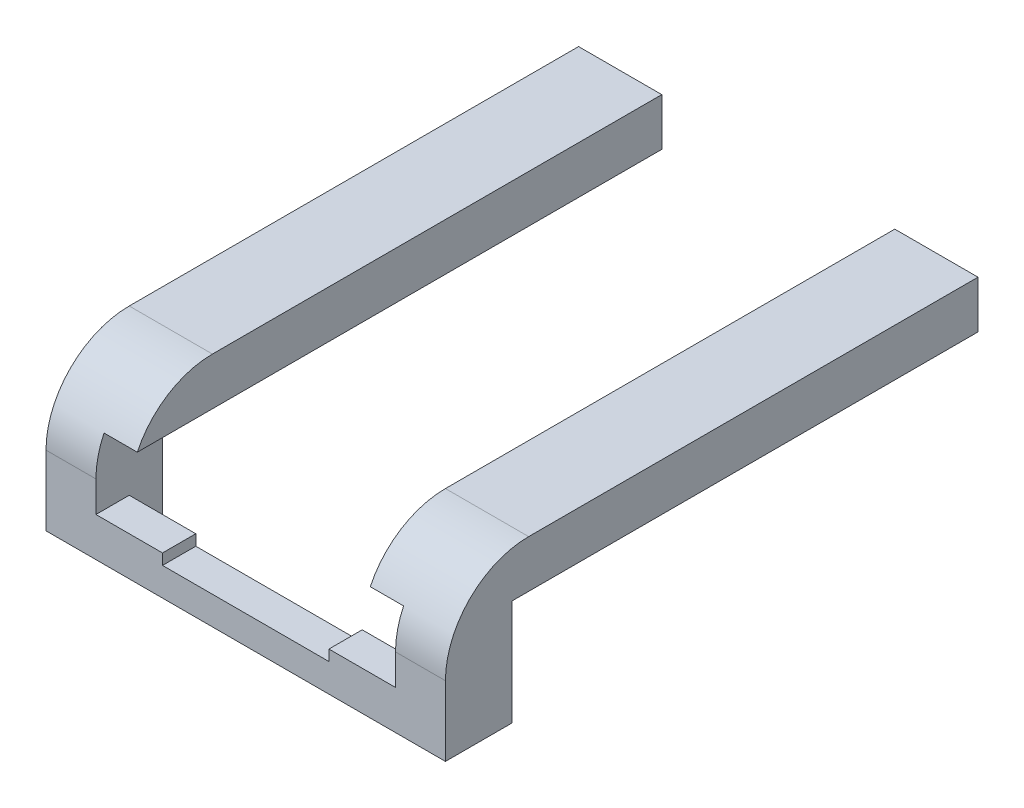
from build123d import *

# Parameters (mm, degrees)
BOSS_EXTRU_1_DEPTH = 1.7
ESQUISSE2_W        = 3
ESQUISSE2_H        = 4
BOSS_EXTRU_2_DEPTH = 7.5
ESQUISSE3_W        = 5
ESQUISSE3_H        = 32
BOSS_EXTRU_3_DEPTH = 2.85
CONG_1_R           = 5
ESQUISSE4_W        = 4
ESQUISSE4_H        = 2
BOSS_EXTRU_4_DEPTH = 0.65


with BuildPart() as part:
    # Esquisse1 → Boss.-Extru.1 (new body)
    with BuildSketch(Plane(origin=(0, 0, 0), x_dir=(1, 0, 0), z_dir=(0, 1, 0))):
        Polygon((-12, 4), (-9, 4), (-9, 2), (9, 2), (9, 4), (12, 4), (12, 0), (-12, 0), align=None)
    extrude(amount=BOSS_EXTRU_1_DEPTH)

    # Esquisse2 → Boss.-Extru.2 (add)
    with BuildSketch(Plane(origin=(0, 1.7, 0), x_dir=(1, 0, 0), z_dir=(0, 1, 0))):
        with Locations((-10.5, 2)):
            Rectangle(ESQUISSE2_W, ESQUISSE2_H)
        with Locations((10.5, 2)):
            Rectangle(ESQUISSE2_W, ESQUISSE2_H)
    extrude(amount=BOSS_EXTRU_2_DEPTH)

    # Esquisse3 → Boss.-Extru.3 (add)
    with BuildSketch(Plane(origin=(0, 9.2, 0), x_dir=(1, 0, 0), z_dir=(0, 1, 0))):
        with Locations((-9.5, 16)):
            Rectangle(ESQUISSE3_W, ESQUISSE3_H)
        with Locations((9.5, 16)):
            Rectangle(ESQUISSE3_W, ESQUISSE3_H)
    extrude(amount=-BOSS_EXTRU_3_DEPTH)

    # Congé1
    cong_1_edges = [part.edges().sort_by_distance(p)[0] for p in [
        (9.5, 9.2, 0),
        (-9.5, 9.2, 0),
    ]]
    fillet(cong_1_edges, radius=CONG_1_R)

    # Esquisse4 → Boss.-Extru.4 (add)
    with BuildSketch(Plane(origin=(0, 1.7, 0), x_dir=(1, 0, 0), z_dir=(0, 1, 0))):
        with Locations((-7, 1)):
            Rectangle(ESQUISSE4_W, ESQUISSE4_H)
        with Locations((7, 1)):
            Rectangle(ESQUISSE4_W, ESQUISSE4_H)
    extrude(amount=BOSS_EXTRU_4_DEPTH)


solid = part.part
